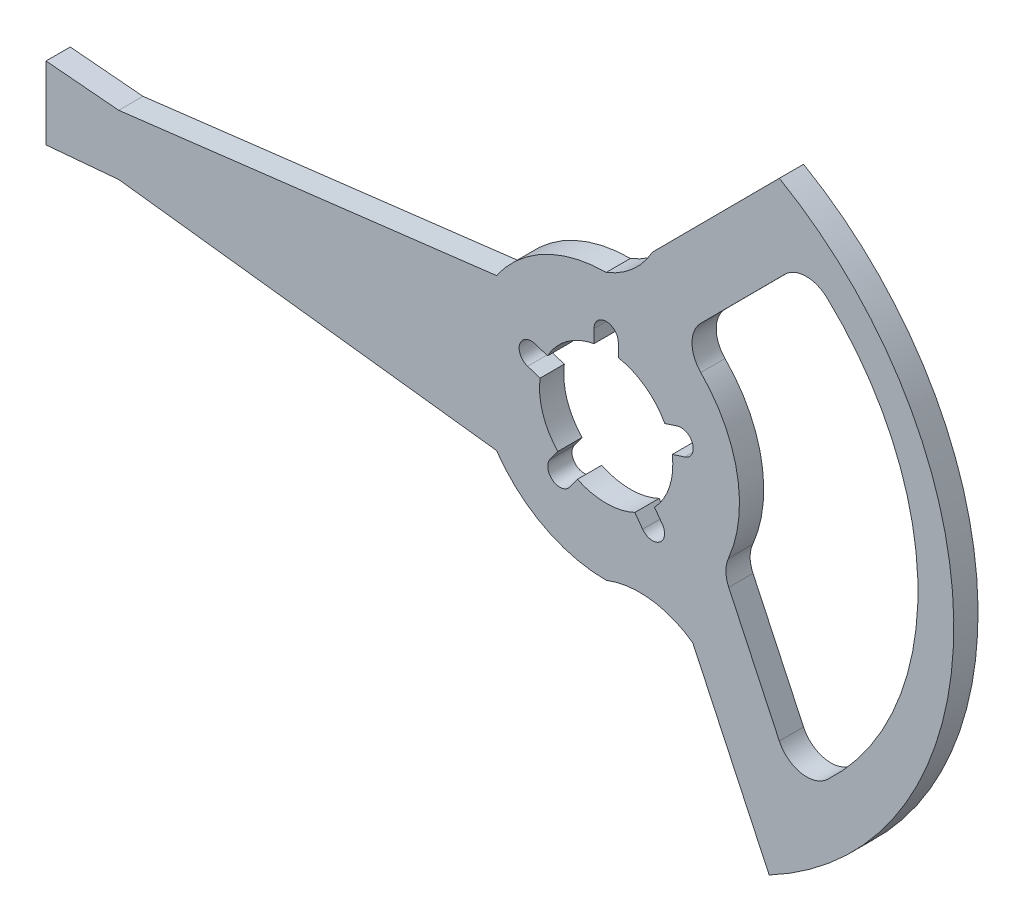
from build123d import *

# Parameters (mm, degrees)
BOSS_EXTRUDE2_DEPTH = 4


with BuildPart() as part:
    # Sketch1 → Boss-Extrude2 (new body)
    # profile 1 of 2: a face of its own
    with BuildSketch(Plane.XY):
        with BuildLine():
            ThreePointArc((-18.10386699, -12.5), (-22, 0), (-18.10386699, 12.5))
            Line((-18.10386699, 12.5), (-80.44, 4.950136038))
            Line((-80.44, 4.950136038), (-92.44, 6))
            Line((-92.44, 6), (-92.44, -6))
            Line((-92.44, -6), (-80.44, -4.950136038))
            Line((-80.44, -4.950136038), (-18.10386699, -12.5))
        make_face()
    # profile 2 of 2: a face of its own
    with BuildSketch(Plane.XY):
        with BuildLine():
            ThreePointArc((0, 22), (4.39692325, 24.688021922), (7.624562296, 28.705576167))
            Line((7.624562296, 28.705576167), (28.576895981, 49.746134685))
            ThreePointArc((28.576895981, 49.746134685), (57.361992188, -0.958515634), (26.898895733, -50.673132016))
            Line((26.898895733, -50.673132016), (14.293358327, -23.788083824))
            ThreePointArc((14.293358327, -23.788083824), (7.375363605, -21.066013146), (0, -22))
            ThreePointArc((0, -22), (-22, 0), (0, 22))
        make_face()
        with BuildLine():
            ThreePointArc((-10.905276344, 1.44046793), (-10.461621679, -3.399186938), (-7.975868085, -7.575323642))
            Line((-7.975868085, -7.575323642), (-9.250831414, -9.330160117))
            ThreePointArc((-9.250831414, -9.330160117), (-8.816778784, -12.135254915), (-6.014845458, -11.681241534))
            Line((-6.014845458, -11.681241534), (-4.73988213, -9.926405059))
            ThreePointArc((-4.73988213, -9.926405059), (0, -11), (4.73988213, -9.926405059))
            Line((4.73988213, -9.926405059), (6.014845458, -11.681241534))
            ThreePointArc((6.014845458, -11.681241534), (8.816778784, -12.135254915), (9.250831414, -9.330160117))
            Line((9.250831414, -9.330160117), (7.975868085, -7.575323642))
            ThreePointArc((7.975868085, -7.575323642), (10.461621679, -3.399186938), (10.905276344, 1.44046793))
            Line((10.905276344, 1.44046793), (12.968210344, 2.110755818))
            ThreePointArc((12.968210344, 2.110755818), (14.265847744, 4.635254915), (11.732173696, 5.914885461))
            Line((11.732173696, 5.914885461), (9.669239696, 5.244597572))
            ThreePointArc((9.669239696, 5.244597572), (6.465637775, 8.899186938), (1.999949308, 10.816663199))
            Line((1.999949308, 10.816663199), (1.999949308, 12.985760372))
            ThreePointArc((1.999949308, 12.985760372), (0, 15), (-1.999949308, 12.985760372))
            Line((-1.999949308, 12.985760372), (-1.999949308, 10.816663199))
            ThreePointArc((-1.999949308, 10.816663199), (-6.465637775, 8.899186938), (-9.669239696, 5.244597572))
            Line((-9.669239696, 5.244597572), (-11.732173696, 5.914885461))
            ThreePointArc((-11.732173696, 5.914885461), (-14.265847744, 4.635254915), (-12.968210344, 2.110755818))
            Line((-12.968210344, 2.110755818), (-10.905276344, 1.44046793))
        make_face(mode=Mode.SUBTRACT)
        with BuildLine():
            ThreePointArc((20.173023673, -8.777762578), (21.622154849, 4.05985464), (15.61502008, 15.497456175))
            ThreePointArc((15.61502008, 15.497456175), (14.163890039, 19.023799586), (15.620934225, 22.547703457))
            Line((15.620934225, 22.547703457), (29.479774673, 36.464899881))
            ThreePointArc((29.479774673, 36.464899881), (32.923189008, 37.935810816), (36.42242793, 36.603141231))
            ThreePointArc((36.42242793, 36.603141231), (51.457765207, 2.212369547), (36.504075375, -32.213982342))
            ThreePointArc((36.504075375, -32.213982342), (32.145722027, -33.464647666), (28.568596515, -30.678327382))
            Line((28.568596515, -30.678327382), (20.230712329, -12.895315764))
            ThreePointArc((20.230712329, -12.895315764), (19.758292439, -10.842753852), (20.173023673, -8.777762578))
        make_face(mode=Mode.SUBTRACT)
    extrude(amount=BOSS_EXTRUDE2_DEPTH)


solid = part.part
